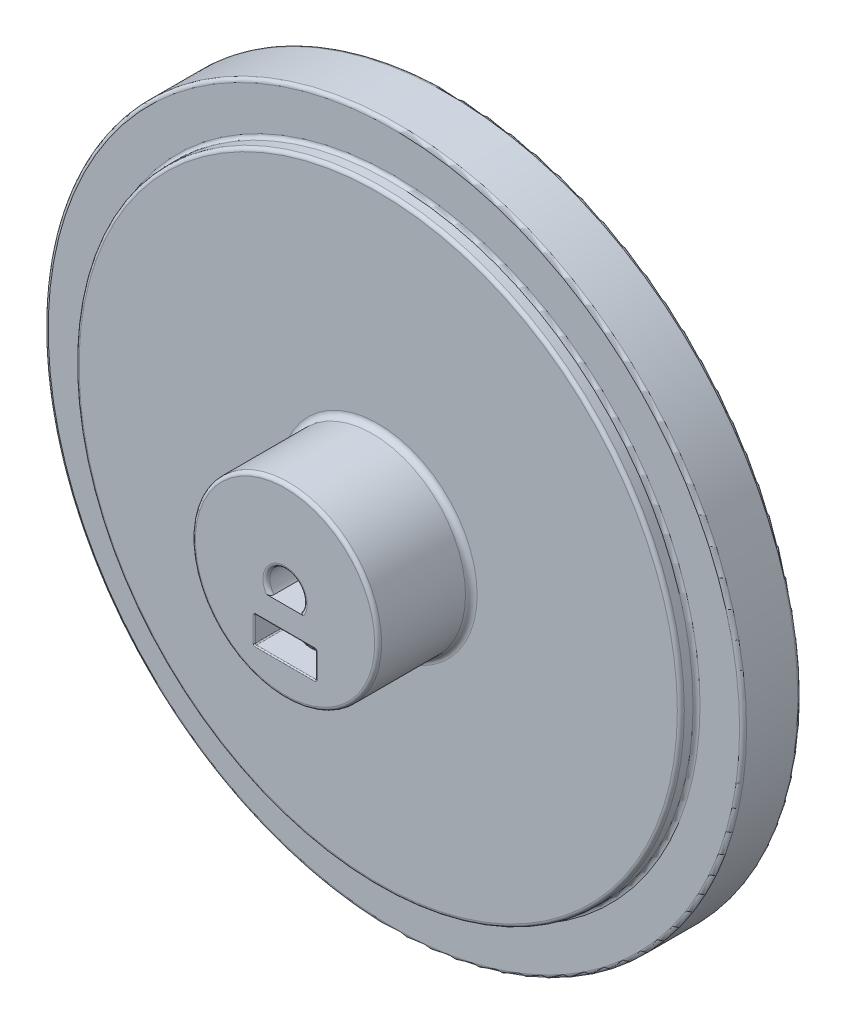
from build123d import *

# Parameters (mm, degrees)
SKETCH1_R           = 30
BOSS_EXTRUDE1_DEPTH = 3.85
SKETCH4_R           = 8
BOSS_EXTRUDE2_DEPTH = 8
CUT_EXTRUDE1_DEPTH  = 9
SKETCH6_R           = 2
CUT_EXTRUDE2_DEPTH  = 45.05022701417099
FILLET1_R           = 0.5
FILLET2_R           = 0.3
FILLET3_R           = 0.3
FILLET4_R           = 0.3
FILLET5_R           = 0.3
SKETCH8_W           = 5.3
SKETCH8_H           = 2.3
CUT_EXTRUDE3_DEPTH  = 9
FILLET6_R           = 0.1


with BuildPart() as part:
    # Sketch1 → Boss-Extrude1 (new, symmetric)
    with BuildSketch(Plane.XY):
        with Locations(Location((0, 0, 0), (0, 0, 180))):
            Circle(SKETCH1_R)
    extrude(amount=BOSS_EXTRUDE1_DEPTH, both=True)

    # Cut-Sweep1: sweep along a curve in space
    with BuildLine() as cut_sweep1_path:
        ThreePointArc((30, 0, -3.85), (21.213203435596427, 21.213203435596423, -3.85), (0, 30, -3.85))
        ThreePointArc((0, 30, -3.85), (-21.213203435596423, 21.213203435596427, -3.85), (-30, 0, -3.85))
        ThreePointArc((-30, 0, -3.85), (-21.213203435596427, -21.213203435596423, -3.85), (0, -30, -3.85))
        ThreePointArc((0, -30, -3.85), (21.213203435596423, -21.213203435596427, -3.85), (30, 0, -3.85))
    # Sketch2 → Cut-Sweep1 (sweep, cut)
    with BuildSketch(Plane(origin=(0, 0, 0), x_dir=(1, 0, 0), z_dir=(0, 1, 0))):
        Polygon((26, 2.4999999999999973), (36.87716812348415, 2.4999999999999973), (36.87716812348415, -2.5000000000000027), (26, -2.5000000000000027), (26, -7.255807333347117), (39.504334597435395, -7.255807333347117), (39.504334597435395, 7.255807333347112), (26, 7.255807333347112), align=None)
    sweep(path=cut_sweep1_path.line, mode=Mode.SUBTRACT)

    # Sketch4 → Boss-Extrude2 (add)
    with BuildSketch(Plane.XY.offset(3.85)):
        Circle(SKETCH4_R)
    extrude(amount=BOSS_EXTRUDE2_DEPTH)

    # Sketch5 → Cut-Extrude1 (cut)
    with BuildSketch(Plane.XY.offset(11.85)):
        with BuildLine():
            Line((-1.2489995996796797, -1), (1.2489995996796797, -1))
            ThreePointArc((1.2489995996796797, -1), (1e-16, 1.6), (-1.2489995996796797, -1))
        make_face()
    extrude(amount=-CUT_EXTRUDE1_DEPTH, mode=Mode.SUBTRACT)

    # Sketch6 → Cut-Extrude2 (cut, through all)
    with BuildSketch(Plane(origin=(0, 0, 0), x_dir=(1, 0, 0), z_dir=(0, 1, 0))):
        with Locations(Location((0, -7.55, 0), (0, 0, 270))):
            Circle(SKETCH6_R)
    extrude(amount=-CUT_EXTRUDE2_DEPTH, mode=Mode.SUBTRACT)

    # Fillet1
    fillet1_edges = [part.edges().sort_by_distance(p)[0] for p in [
        (-8, 9.8e-16, 3.85),
    ]]
    fillet(fillet1_edges, radius=FILLET1_R)

    # Fillet2
    fillet2_edges = [part.edges().sort_by_distance(p)[0] for p in [
        (-8, 9.8e-16, 11.85),
    ]]
    fillet(fillet2_edges, radius=FILLET2_R)

    # Fillet3
    fillet3_edges = [part.edges().sort_by_distance(p)[0] for p in [
        (5.9199401e-10, -7.999999994410225, 5.549999985910574),
    ]]
    fillet(fillet3_edges, radius=FILLET3_R)

    # Fillet4
    fillet4_edges = [part.edges().sort_by_distance(p)[0] for p in [
        (-2.8e-16, 1.6, 11.85),
    ]]
    fillet(fillet4_edges, radius=FILLET4_R)

    # Fillet5
    fillet5_edges = [part.edges().sort_by_distance(p)[0] for p in [
        (-2.061e-14, 26.000000000000007, 2.500000000000003),
        (2.168e-14, 26.00000000000003, -2.4999999999999973),
        (-5.18e-15, 26, -3.85),
        (-5.18e-15, 26, 3.85),
        (30, -2.067e-14, 2.500000000000003),
        (30, -2.067e-14, -2.4999999999999973),
    ]]
    fillet(fillet5_edges, radius=FILLET5_R)

    # Sketch8 → Cut-Extrude3 (cut)
    with BuildSketch(Plane.XY.offset(11.85)):
        with Locations((0, -4.15)):
            Rectangle(SKETCH8_W, SKETCH8_H)
    extrude(amount=-CUT_EXTRUDE3_DEPTH, mode=Mode.SUBTRACT)

    # Fillet6
    fillet6_edges = [part.edges().sort_by_distance(p)[0] for p in [
        (0, -3, 2.8499999999999996),
        (-2.65, -3, 7.35),
        (6.1e-16, -3, 5.55),
        (0, -5.3, 2.8499999999999996),
        (2.65, -5.3, 7.35),
        (6.1e-16, -5.3, 5.55),
        (-2.65, -4.15, 2.8499999999999996),
        (-2.65, -5.3, 7.35),
        (2.65, -4.15, 2.8499999999999996),
        (2.65, -3, 7.35),
        (-2.65, -4.15, 11.85),
        (0, -5.3, 11.85),
        (2.65, -4.15, 11.85),
        (0, -3, 11.85),
    ]]
    fillet(fillet6_edges, radius=FILLET6_R)


solid = part.part
